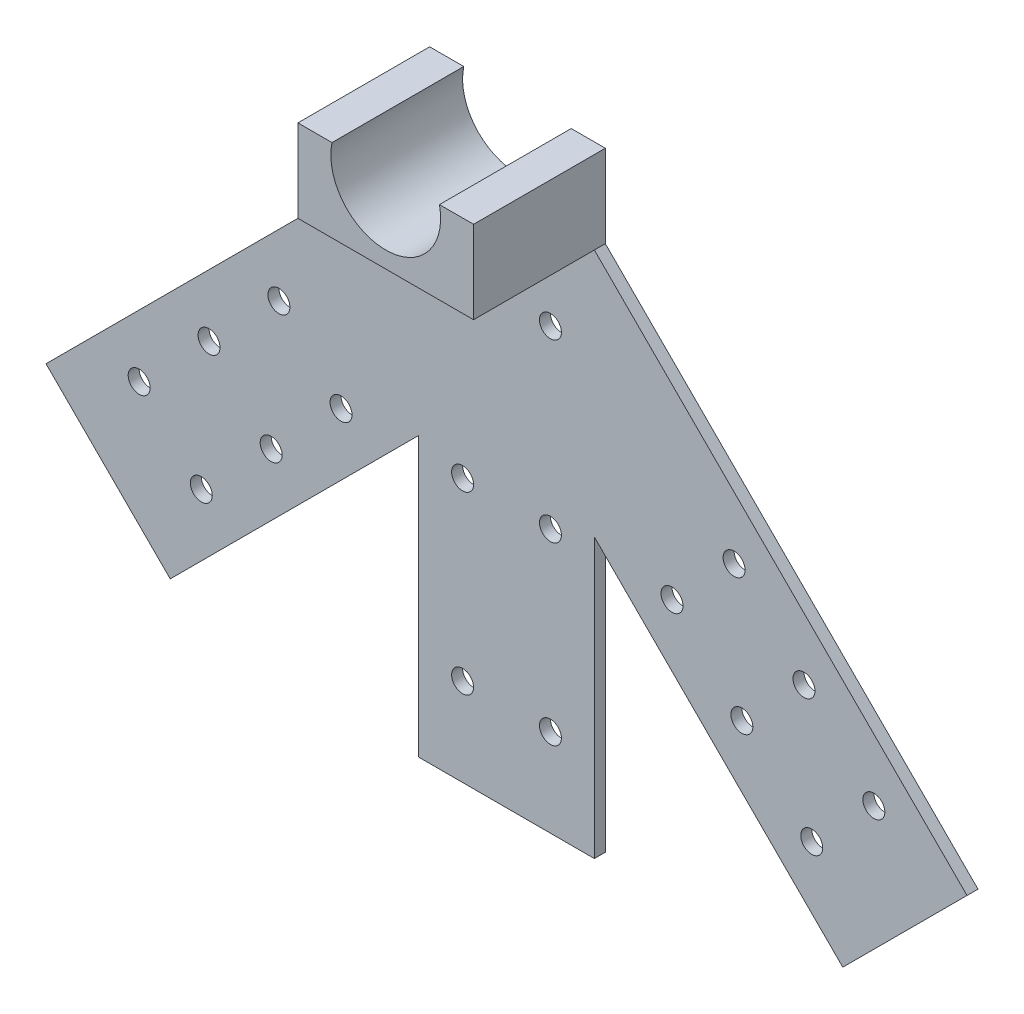
from build123d import *

# Parameters (mm, degrees)
SKETCH2_R           = 6.35
BOSS_EXTRUDE1_DEPTH = 6.35
SKETCH3_W           = 101.6
SKETCH3_H           = 76.2
BOSS_EXTRUDE3_DEPTH = 47.8
CUT_EXTRUDE1_DEPTH  = 449.400286045


with BuildPart() as part:
    # Sketch2 → Boss-Extrude1 (new body)
    with BuildSketch(Plane.XY):
        Polygon((-50.8, 0), (50.8, 0), (50.8, 161.115902063), (194.484097937, 17.431804126), (266.326146906, 89.273853094), (50.8, 304.8), (-50.8, 304.8), (-266.326146906, 89.273853094), (-194.484097937, 17.431804126), (-50.8, 161.115902063), align=None)
        with Locations((212.444610179, 107.234365336)):
            Circle(SKETCH2_R, mode=Mode.SUBTRACT)
        with Locations((172.033457634, 147.645517881)):
            Circle(SKETCH2_R, mode=Mode.SUBTRACT)
        with Locations((131.62230509, 188.056670426)):
            Circle(SKETCH2_R, mode=Mode.SUBTRACT)
        with Locations(Location((136.11243315, 111.724493397, 0), (0, 0, 180))):
            Circle(SKETCH2_R, mode=Mode.SUBTRACT)
        with Locations(Location((95.701280605, 152.135645942, 0), (0, 0, 180))):
            Circle(SKETCH2_R, mode=Mode.SUBTRACT)
        with Locations(Location((176.523585695, 71.313340852, 0), (0, 0, 180))):
            Circle(SKETCH2_R, mode=Mode.SUBTRACT)
        with Locations((25.4, 50.8)):
            Circle(SKETCH2_R, mode=Mode.SUBTRACT)
        with Locations((25.4, 152.4)):
            Circle(SKETCH2_R, mode=Mode.SUBTRACT)
        with Locations((25.4, 254)):
            Circle(SKETCH2_R, mode=Mode.SUBTRACT)
        with Locations(Location((-25.4, 254, 0), (0, 0, 180))):
            Circle(SKETCH2_R, mode=Mode.SUBTRACT)
        with Locations(Location((-25.4, 152.4, 0), (0, 0, 180))):
            Circle(SKETCH2_R, mode=Mode.SUBTRACT)
        with Locations(Location((-25.4, 50.8, 0), (0, 0, 180))):
            Circle(SKETCH2_R, mode=Mode.SUBTRACT)
        with Locations((-176.523585695, 71.313340852)):
            Circle(SKETCH2_R, mode=Mode.SUBTRACT)
        with Locations((-95.701280605, 152.135645942)):
            Circle(SKETCH2_R, mode=Mode.SUBTRACT)
        with Locations((-136.11243315, 111.724493397)):
            Circle(SKETCH2_R, mode=Mode.SUBTRACT)
        with Locations(Location((-131.62230509, 188.056670426, 0), (0, 0, 180))):
            Circle(SKETCH2_R, mode=Mode.SUBTRACT)
        with Locations(Location((-172.033457634, 147.645517881, 0), (0, 0, 180))):
            Circle(SKETCH2_R, mode=Mode.SUBTRACT)
        with Locations(Location((-212.444610179, 107.234365336, 0), (0, 0, 180))):
            Circle(SKETCH2_R, mode=Mode.SUBTRACT)
    extrude(amount=BOSS_EXTRUDE1_DEPTH)

    # Sketch3 → Boss-Extrude3 (add)
    with BuildSketch(Plane(origin=(0, 304.8, 0), x_dir=(1, 0, 0), z_dir=(0, 1, 0))):
        with Locations((0, -38.1)):
            Rectangle(SKETCH3_W, SKETCH3_H)
    extrude(amount=BOSS_EXTRUDE3_DEPTH)

    # Sketch4 → Cut-Extrude1 (cut, through all)
    with BuildSketch(Plane.XY.offset(76.2)):
        with BuildLine():
            Line((-31.068100257, 352.6), (31.068100257, 352.6))
            ThreePointArc((31.068100257, 352.6), (0, 314.305105316), (-31.068100257, 352.6))
        make_face()
    extrude(amount=-CUT_EXTRUDE1_DEPTH, mode=Mode.SUBTRACT)


solid = part.part
